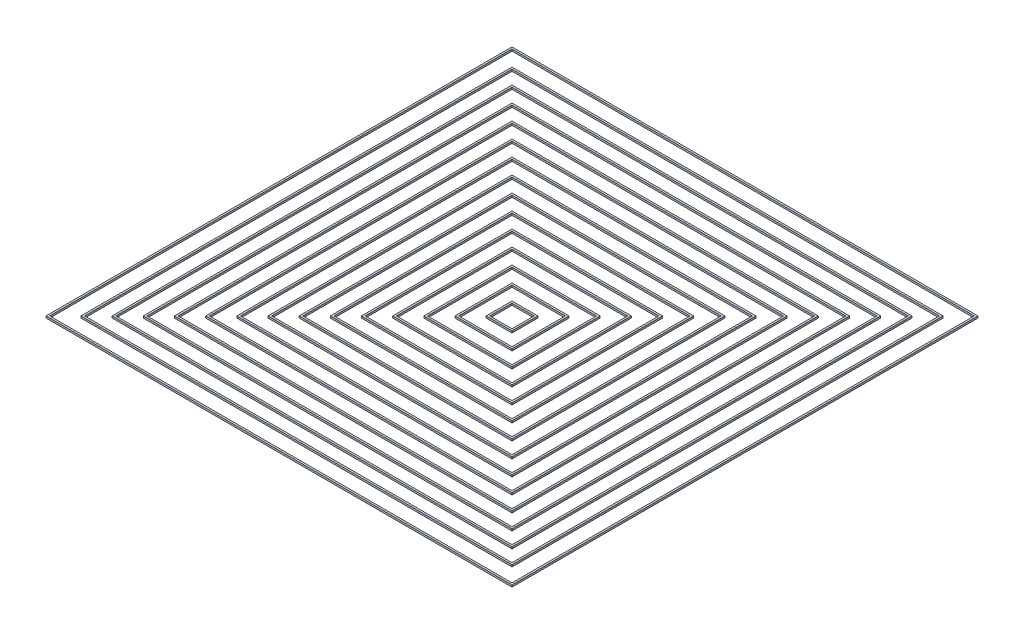
from build123d import *

# Parameters (mm, degrees)
SKETCH1_W              = 299
SKETCH1_H              = 299
SKETCH1_W_2            = 296.6
SKETCH1_H_2            = 296.6
BOSS_EXTRUDE2_DEPTH    = 1.2
SKETCH1_W_3            = 276.6
SKETCH1_H_3            = 276.6
SKETCH1_W_4            = 274.2
SKETCH1_H_4            = 274.2
BOSS_EXTRUDE2_2_DEPTH  = 1.2
SKETCH1_W_5            = 256.6
SKETCH1_H_5            = 256.6
SKETCH1_W_6            = 254.2
SKETCH1_H_6            = 254.2
BOSS_EXTRUDE2_3_DEPTH  = 1.2
SKETCH1_W_7            = 236.6
SKETCH1_H_7            = 236.6
SKETCH1_W_8            = 234.2
SKETCH1_H_8            = 234.2
BOSS_EXTRUDE2_4_DEPTH  = 1.2
SKETCH1_W_9            = 216.6
SKETCH1_H_9            = 216.6
SKETCH1_W_10           = 214.2
SKETCH1_H_10           = 214.2
BOSS_EXTRUDE2_5_DEPTH  = 1.2
SKETCH1_W_11           = 196.6
SKETCH1_H_11           = 196.6
SKETCH1_W_12           = 194.2
SKETCH1_H_12           = 194.2
BOSS_EXTRUDE2_6_DEPTH  = 1.2
SKETCH1_W_13           = 176.6
SKETCH1_H_13           = 176.6
SKETCH1_W_14           = 174.2
SKETCH1_H_14           = 174.2
BOSS_EXTRUDE2_7_DEPTH  = 1.2
SKETCH1_W_15           = 156.6
SKETCH1_H_15           = 156.6
SKETCH1_W_16           = 154.2
SKETCH1_H_16           = 154.2
BOSS_EXTRUDE2_8_DEPTH  = 1.2
SKETCH1_W_17           = 136.6
SKETCH1_H_17           = 136.6
SKETCH1_W_18           = 134.2
SKETCH1_H_18           = 134.2
BOSS_EXTRUDE2_9_DEPTH  = 1.2
SKETCH1_W_19           = 116.6
SKETCH1_H_19           = 116.6
SKETCH1_W_20           = 114.2
SKETCH1_H_20           = 114.2
BOSS_EXTRUDE2_10_DEPTH = 1.2
SKETCH1_W_21           = 96.6
SKETCH1_H_21           = 96.6
SKETCH1_W_22           = 94.2
SKETCH1_H_22           = 94.2
BOSS_EXTRUDE2_11_DEPTH = 1.2
SKETCH1_W_23           = 76.6
SKETCH1_H_23           = 76.6
SKETCH1_W_24           = 74.2
SKETCH1_H_24           = 74.2
BOSS_EXTRUDE2_12_DEPTH = 1.2
SKETCH1_W_25           = 56.6
SKETCH1_H_25           = 56.6
SKETCH1_W_26           = 54.2
SKETCH1_H_26           = 54.2
BOSS_EXTRUDE2_13_DEPTH = 1.2
SKETCH1_W_27           = 36.6
SKETCH1_H_27           = 36.6
SKETCH1_W_28           = 34.2
SKETCH1_H_28           = 34.2
BOSS_EXTRUDE2_14_DEPTH = 1.2
SKETCH1_W_29           = 16.6
SKETCH1_H_29           = 16.6
SKETCH1_W_30           = 14.2
SKETCH1_H_30           = 14.2
BOSS_EXTRUDE2_15_DEPTH = 1.2


with BuildPart() as part:
    # Sketch1 → Boss-Extrude2 (new body)
    with BuildSketch(Plane(origin=(0, 0, 0), x_dir=(1, 0, 0), z_dir=(0, 1, 0))):
        with Locations((149.5, -149.5)):
            Rectangle(SKETCH1_W, SKETCH1_H)
        with Locations((149.5, -149.5)):
            Rectangle(SKETCH1_W_2, SKETCH1_H_2, mode=Mode.SUBTRACT)
    extrude(amount=BOSS_EXTRUDE2_DEPTH)


with BuildPart() as body_2:
    # Sketch1 → Boss-Extrude2 2 (new body)
    with BuildSketch(Plane(origin=(0, 0, 0), x_dir=(1, 0, 0), z_dir=(0, 1, 0))):
        with Locations((149.5, -149.5)):
            Rectangle(SKETCH1_W_3, SKETCH1_H_3)
        with Locations((149.5, -149.5)):
            Rectangle(SKETCH1_W_4, SKETCH1_H_4, mode=Mode.SUBTRACT)
    extrude(amount=BOSS_EXTRUDE2_2_DEPTH)


with BuildPart() as body_3:
    # Sketch1 → Boss-Extrude2 3 (new body)
    with BuildSketch(Plane(origin=(0, 0, 0), x_dir=(1, 0, 0), z_dir=(0, 1, 0))):
        with Locations((149.5, -149.5)):
            Rectangle(SKETCH1_W_5, SKETCH1_H_5)
        with Locations((149.5, -149.5)):
            Rectangle(SKETCH1_W_6, SKETCH1_H_6, mode=Mode.SUBTRACT)
    extrude(amount=BOSS_EXTRUDE2_3_DEPTH)


with BuildPart() as body_4:
    # Sketch1 → Boss-Extrude2 4 (new body)
    with BuildSketch(Plane(origin=(0, 0, 0), x_dir=(1, 0, 0), z_dir=(0, 1, 0))):
        with Locations((149.5, -149.5)):
            Rectangle(SKETCH1_W_7, SKETCH1_H_7)
        with Locations((149.5, -149.5)):
            Rectangle(SKETCH1_W_8, SKETCH1_H_8, mode=Mode.SUBTRACT)
    extrude(amount=BOSS_EXTRUDE2_4_DEPTH)


with BuildPart() as body_5:
    # Sketch1 → Boss-Extrude2 5 (new body)
    with BuildSketch(Plane(origin=(0, 0, 0), x_dir=(1, 0, 0), z_dir=(0, 1, 0))):
        with Locations((149.5, -149.5)):
            Rectangle(SKETCH1_W_9, SKETCH1_H_9)
        with Locations((149.5, -149.5)):
            Rectangle(SKETCH1_W_10, SKETCH1_H_10, mode=Mode.SUBTRACT)
    extrude(amount=BOSS_EXTRUDE2_5_DEPTH)


with BuildPart() as body_6:
    # Sketch1 → Boss-Extrude2 6 (new body)
    with BuildSketch(Plane(origin=(0, 0, 0), x_dir=(1, 0, 0), z_dir=(0, 1, 0))):
        with Locations((149.5, -149.5)):
            Rectangle(SKETCH1_W_11, SKETCH1_H_11)
        with Locations((149.5, -149.5)):
            Rectangle(SKETCH1_W_12, SKETCH1_H_12, mode=Mode.SUBTRACT)
    extrude(amount=BOSS_EXTRUDE2_6_DEPTH)


with BuildPart() as body_7:
    # Sketch1 → Boss-Extrude2 7 (new body)
    with BuildSketch(Plane(origin=(0, 0, 0), x_dir=(1, 0, 0), z_dir=(0, 1, 0))):
        with Locations((149.5, -149.5)):
            Rectangle(SKETCH1_W_13, SKETCH1_H_13)
        with Locations((149.5, -149.5)):
            Rectangle(SKETCH1_W_14, SKETCH1_H_14, mode=Mode.SUBTRACT)
    extrude(amount=BOSS_EXTRUDE2_7_DEPTH)


with BuildPart() as body_8:
    # Sketch1 → Boss-Extrude2 8 (new body)
    with BuildSketch(Plane(origin=(0, 0, 0), x_dir=(1, 0, 0), z_dir=(0, 1, 0))):
        with Locations((149.5, -149.5)):
            Rectangle(SKETCH1_W_15, SKETCH1_H_15)
        with Locations((149.5, -149.5)):
            Rectangle(SKETCH1_W_16, SKETCH1_H_16, mode=Mode.SUBTRACT)
    extrude(amount=BOSS_EXTRUDE2_8_DEPTH)


with BuildPart() as body_9:
    # Sketch1 → Boss-Extrude2 9 (new body)
    with BuildSketch(Plane(origin=(0, 0, 0), x_dir=(1, 0, 0), z_dir=(0, 1, 0))):
        with Locations((149.5, -149.5)):
            Rectangle(SKETCH1_W_17, SKETCH1_H_17)
        with Locations((149.5, -149.5)):
            Rectangle(SKETCH1_W_18, SKETCH1_H_18, mode=Mode.SUBTRACT)
    extrude(amount=BOSS_EXTRUDE2_9_DEPTH)


with BuildPart() as body_10:
    # Sketch1 → Boss-Extrude2 10 (new body)
    with BuildSketch(Plane(origin=(0, 0, 0), x_dir=(1, 0, 0), z_dir=(0, 1, 0))):
        with Locations((149.5, -149.5)):
            Rectangle(SKETCH1_W_19, SKETCH1_H_19)
        with Locations((149.5, -149.5)):
            Rectangle(SKETCH1_W_20, SKETCH1_H_20, mode=Mode.SUBTRACT)
    extrude(amount=BOSS_EXTRUDE2_10_DEPTH)


with BuildPart() as body_11:
    # Sketch1 → Boss-Extrude2 11 (new body)
    with BuildSketch(Plane(origin=(0, 0, 0), x_dir=(1, 0, 0), z_dir=(0, 1, 0))):
        with Locations((149.5, -149.5)):
            Rectangle(SKETCH1_W_21, SKETCH1_H_21)
        with Locations((149.5, -149.5)):
            Rectangle(SKETCH1_W_22, SKETCH1_H_22, mode=Mode.SUBTRACT)
    extrude(amount=BOSS_EXTRUDE2_11_DEPTH)


with BuildPart() as body_12:
    # Sketch1 → Boss-Extrude2 12 (new body)
    with BuildSketch(Plane(origin=(0, 0, 0), x_dir=(1, 0, 0), z_dir=(0, 1, 0))):
        with Locations((149.5, -149.5)):
            Rectangle(SKETCH1_W_23, SKETCH1_H_23)
        with Locations((149.5, -149.5)):
            Rectangle(SKETCH1_W_24, SKETCH1_H_24, mode=Mode.SUBTRACT)
    extrude(amount=BOSS_EXTRUDE2_12_DEPTH)


with BuildPart() as body_13:
    # Sketch1 → Boss-Extrude2 13 (new body)
    with BuildSketch(Plane(origin=(0, 0, 0), x_dir=(1, 0, 0), z_dir=(0, 1, 0))):
        with Locations((149.5, -149.5)):
            Rectangle(SKETCH1_W_25, SKETCH1_H_25)
        with Locations((149.5, -149.5)):
            Rectangle(SKETCH1_W_26, SKETCH1_H_26, mode=Mode.SUBTRACT)
    extrude(amount=BOSS_EXTRUDE2_13_DEPTH)


with BuildPart() as body_14:
    # Sketch1 → Boss-Extrude2 14 (new body)
    with BuildSketch(Plane(origin=(0, 0, 0), x_dir=(1, 0, 0), z_dir=(0, 1, 0))):
        with Locations((149.5, -149.5)):
            Rectangle(SKETCH1_W_27, SKETCH1_H_27)
        with Locations((149.5, -149.5)):
            Rectangle(SKETCH1_W_28, SKETCH1_H_28, mode=Mode.SUBTRACT)
    extrude(amount=BOSS_EXTRUDE2_14_DEPTH)


with BuildPart() as body_15:
    # Sketch1 → Boss-Extrude2 15 (new body)
    with BuildSketch(Plane(origin=(0, 0, 0), x_dir=(1, 0, 0), z_dir=(0, 1, 0))):
        with Locations((149.5, -149.5)):
            Rectangle(SKETCH1_W_29, SKETCH1_H_29)
        with Locations((149.5, -149.5)):
            Rectangle(SKETCH1_W_30, SKETCH1_H_30, mode=Mode.SUBTRACT)
    extrude(amount=BOSS_EXTRUDE2_15_DEPTH)


solid = Compound([part.part, body_2.part, body_3.part, body_4.part, body_5.part, body_6.part, body_7.part, body_8.part, body_9.part, body_10.part, body_11.part, body_12.part, body_13.part, body_14.part, body_15.part])
